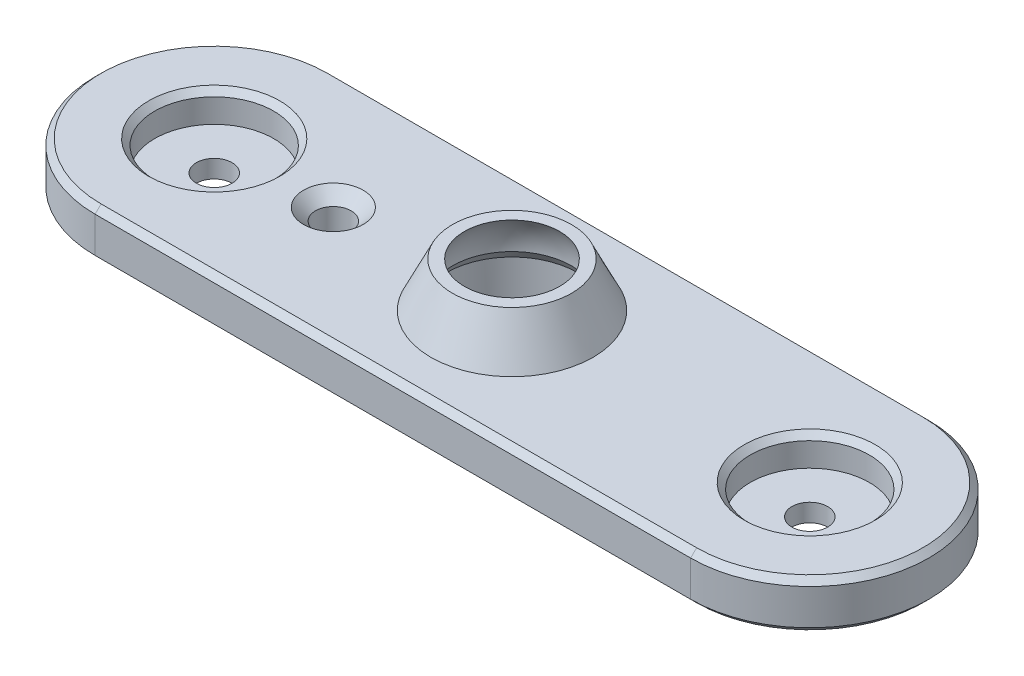
from build123d import *

# Parameters (mm, degrees)
CROQUIS2_R              = 1.5
SALIENTE_EXTRUIR1_DEPTH = 4
CROQUIS3_R              = 5
CORTAR_EXTRUIR1_DEPTH   = 2.5
CROQUIS6_R              = 5.5
CORTAR_EXTRUIR2_DEPTH   = 37.619666847
CHAFL_N1_SIZE           = 1
CHAFL_N2_SIZE           = 0.5


with BuildPart() as part:
    # Croquis2 → Saliente-Extruir1 (new body)
    with BuildSketch(Plane(origin=(0, 0, 0), x_dir=(1, 0, 0), z_dir=(0, 1, 0))):
        with BuildLine():
            Line((-25, 10), (25, 10))
            ThreePointArc((25, 10), (35, 0), (25, -10))
            Line((25, -10), (-25, -10))
            ThreePointArc((-25, -10), (-35, 0), (-25, 10))
        make_face()
        with Locations(Location((-25, 0, 0), (0, 0, 270))):
            Circle(CROQUIS2_R, mode=Mode.SUBTRACT)
        with Locations(Location((25, 0, 0), (0, 0, 270))):
            Circle(CROQUIS2_R, mode=Mode.SUBTRACT)
        with Locations(Location((-15, 0, 0), (0, 0, 270))):
            Circle(CROQUIS2_R, mode=Mode.SUBTRACT)
    extrude(amount=SALIENTE_EXTRUIR1_DEPTH)

    # Croquis3 → Cortar-Extruir1 (cut)
    with BuildSketch(Plane(origin=(0, 4, 0), x_dir=(1, 0, 0), z_dir=(0, 1, 0))):
        with Locations(Location((-25, 0, 0), (0, 0, 270))):
            Circle(CROQUIS3_R)
        with Locations(Location((25, 0, 0), (0, 0, 270))):
            Circle(CROQUIS3_R)
    extrude(amount=-CORTAR_EXTRUIR1_DEPTH, mode=Mode.SUBTRACT)

    # Croquis6 → Cortar-Extruir2 (cut, through all)
    with BuildSketch(Plane(origin=(0, 4, 0), x_dir=(1, 0, 0), z_dir=(0, 1, 0))):
        with Locations(Location((0, 0, 0), (0, 0, 270))):
            Circle(CROQUIS6_R)
    extrude(amount=-CORTAR_EXTRUIR2_DEPTH, mode=Mode.SUBTRACT)

    # Croquis5 → Revolución1 (revolve)
    with BuildSketch(Plane.XY, mode=Mode.PRIVATE) as revoluci_n1_sk:
        with BuildLine():
            Line((5, 4.75), (5.5, 4))
            Line((5.5, 4), (6.8125, 4))
            Line((6.8125, 4), (5, 7.75))
            Line((5, 7.75), (4, 7.75))
            ThreePointArc((4, 7.75), (4.74341649, 6.33113883), (5, 4.75))
        make_face()
    revolve(revoluci_n1_sk.sketch.rotate(Axis((0, -0.25, 0), (0, 1, 0)), 90), axis=Axis((0, -0.25, 0), (0, 1, 0)))

    # Chaflán1
    chafl_n1_edges = [part.edges().sort_by_distance(p)[0] for p in [
        (-15, 0, -1.5),
        (-15, 4, -1.5),
    ]]
    chamfer(chafl_n1_edges, length=CHAFL_N1_SIZE)

    # Chaflán2
    chafl_n2_edges = [part.edges().sort_by_distance(p)[0] for p in [
        (35, 4, 0),
        (0, 4, -10),
        (-25, 4, -5),
        (25, 4, -5),
        (-35, 4, 0),
        (0, 0, -10),
        (35, 0, 0),
        (0, 0, 10),
        (-35, 0, 0),
        (0, 4, 10),
    ]]
    chamfer(chafl_n2_edges, length=CHAFL_N2_SIZE)


solid = part.part
